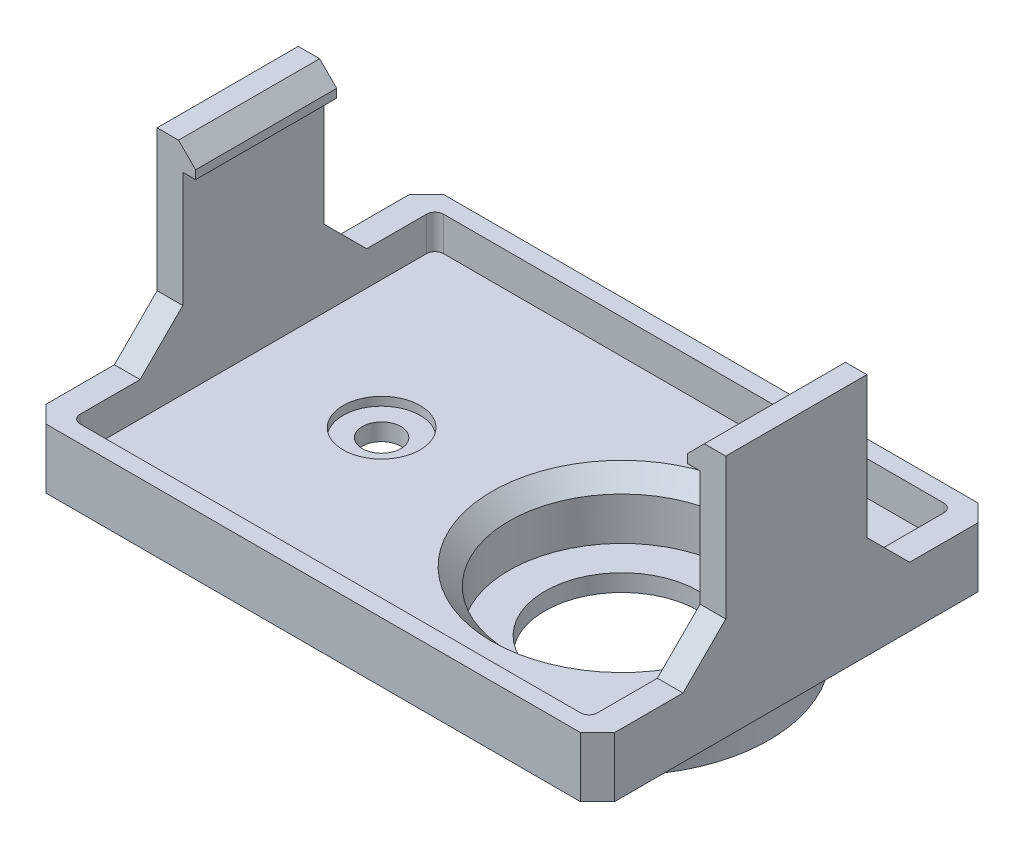
from build123d import *

# Parameters (mm, degrees)
SKETCH1_W           = 66.5
SKETCH1_H           = 46.5
BOSS_EXTRUDE1_DEPTH = 3
SKETCH2_W           = 60.5
SKETCH2_H           = 42.5
BOSS_EXTRUDE2_DEPTH = 4
SKETCH3_R           = 13.2
CUT_EXTRUDE1_DEPTH  = 4
SKETCH4_R           = 2.25
CUT_EXTRUDE2_DEPTH  = 4
SKETCH5_R           = 4.5
CUT_EXTRUDE3_DEPTH  = 1
SKETCH6_R           = 17.2
SKETCH6_R_2         = 13.2
BOSS_EXTRUDE3_DEPTH = 6
FILLET1_R           = 1
CHAMFER1_SIZE       = 2
SKETCH7_W           = 3
SKETCH7_H           = 16.5
BOSS_EXTRUDE4_DEPTH = 21.5
SKETCH8_W           = 16.5
SKETCH8_H           = 3
BOSS_EXTRUDE5_DEPTH = 1.5
SKETCH9_W           = 16.5
SKETCH9_H           = 3
BOSS_EXTRUDE6_DEPTH = 1.5
CHAMFER2_SIZE       = 2
CHAMFER3_SIZE       = 2
CHAMFER4_SIZE       = 2
CHAMFER5_SIZE       = 5
CHAMFER6_SIZE       = 5
BOSS_EXTRUDE7_START = -2
SKETCH10_R          = 13.2
SKETCH10_R_2        = 9
BOSS_EXTRUDE7_DEPTH = 2


with BuildPart() as part:
    # Sketch1 → Boss-Extrude1 (new body)
    with BuildSketch(Plane(origin=(0, 0, 0), x_dir=(1, 0, 0), z_dir=(0, 1, 0))):
        with Locations((0.065324165, -4.697937132)):
            Rectangle(SKETCH1_W, SKETCH1_H)
    extrude(amount=BOSS_EXTRUDE1_DEPTH)

    # Sketch2 → Boss-Extrude2 (add)
    with BuildSketch(Plane(origin=(0, 3, 0), x_dir=(1, 0, 0), z_dir=(0, 1, 0))):
        Polygon((-30.184675835, 18.552062868), (-33.184675835, 18.552062868), (-33.184675835, 16.552062868), (-33.184675835, -25.947937132), (-33.184675835, -27.947937132), (-30.184675835, -27.947937132), (30.315324165, -27.947937132), (33.315324165, -27.947937132), (33.315324165, -25.947937132), (33.315324165, 16.552062868), (33.315324165, 18.552062868), (30.315324165, 18.552062868), align=None)
        with Locations((0.065324165, -4.697937132)):
            Rectangle(SKETCH2_W, SKETCH2_H, mode=Mode.SUBTRACT)
    extrude(amount=BOSS_EXTRUDE2_DEPTH)

    # Sketch3 → Cut-Extrude1 (cut)
    with BuildSketch(Plane(origin=(0, 3, 0), x_dir=(1, 0, 0), z_dir=(0, 1, 0))):
        with Locations(Location((12.915324165, -4.697937132, 0), (0, 0, 270))):
            Circle(SKETCH3_R)
    extrude(amount=-CUT_EXTRUDE1_DEPTH, mode=Mode.SUBTRACT)

    # Sketch4 → Cut-Extrude2 (cut)
    with BuildSketch(Plane(origin=(0, 3, 0), x_dir=(1, 0, 0), z_dir=(0, 1, 0))):
        with Locations(Location((-15.184675835, -4.697937132, 0), (0, 0, 270))):
            Circle(SKETCH4_R)
    extrude(amount=-CUT_EXTRUDE2_DEPTH, mode=Mode.SUBTRACT)

    # Sketch5 → Cut-Extrude3 (cut)
    with BuildSketch(Plane(origin=(0, 3, 0), x_dir=(1, 0, 0), z_dir=(0, 1, 0))):
        with Locations(Location((-15.184675835, -4.697937132, 0), (0, 0, 270))):
            Circle(SKETCH5_R)
    extrude(amount=-CUT_EXTRUDE3_DEPTH, mode=Mode.SUBTRACT)

    # Sketch6 → Boss-Extrude3 (add)
    with BuildSketch(Plane.XZ):
        with Locations(Location((12.915324165, 4.697937132, 0), (0, 0, 90))):
            Circle(SKETCH6_R)
        with Locations(Location((12.915324165, 4.697937132, 0), (0, 0, 90))):
            Circle(SKETCH6_R_2, mode=Mode.SUBTRACT)
    extrude(amount=BOSS_EXTRUDE3_DEPTH)

    # Fillet1
    fillet1_edges = [part.edges().sort_by_distance(p)[0] for p in [
        (-30.184675835, 5, -16.552062868),
        (30.315324165, 5, -16.552062868),
        (30.315324165, 5, 25.947937132),
        (-30.184675835, 5, 25.947937132),
    ]]
    fillet(fillet1_edges, radius=FILLET1_R)

    # Chamfer1
    chamfer1_edges = [part.edges().sort_by_distance(p)[0] for p in [
        (-33.184675835, 3.5, -18.552062868),
        (33.315324165, 3.5, -18.552062868),
        (33.315324165, 3.5, 27.947937132),
        (-33.184675835, 3.5, 27.947937132),
    ]]
    chamfer(chamfer1_edges, length=CHAMFER1_SIZE)

    # Sketch7 → Boss-Extrude4 (add)
    with BuildSketch(Plane(origin=(0, 7, 0), x_dir=(1, 0, 0), z_dir=(0, 1, 0))):
        with Locations((31.815324165, -4.697937132)):
            Rectangle(SKETCH7_W, SKETCH7_H)
        with Locations((-31.684675835, -4.697937132)):
            Rectangle(SKETCH7_W, SKETCH7_H)
    extrude(amount=BOSS_EXTRUDE4_DEPTH)

    # Sketch8 → Boss-Extrude5 (add)
    with BuildSketch(Plane.ZY.offset(-30.315324165)):
        with Locations((4.697937132, 27)):
            Rectangle(SKETCH8_W, SKETCH8_H)
    extrude(amount=BOSS_EXTRUDE5_DEPTH)

    # Sketch9 → Boss-Extrude6 (add)
    with BuildSketch(Plane(origin=(-30.184675835, 0, 0), x_dir=(0, 0, -1), z_dir=(1, 0, 0))):
        with Locations((-4.697937132, 27)):
            Rectangle(SKETCH9_W, SKETCH9_H)
    extrude(amount=BOSS_EXTRUDE6_DEPTH)

    # Chamfer2
    chamfer2_edges = [part.edges().sort_by_distance(p)[0] for p in [
        (28.815324165, 28.5, 4.697937132),
        (-28.684675835, 28.5, 4.697937132),
    ]]
    chamfer(chamfer2_edges, length=CHAMFER2_SIZE)

    # Chamfer3
    chamfer3_edges = [part.edges().sort_by_distance(p)[0] for p in [
        (12.915324165, 3, -8.502062868),
    ]]
    chamfer(chamfer3_edges, length=CHAMFER3_SIZE)

    # Chamfer4
    chamfer4_edges = [part.edges().sort_by_distance(p)[0] for p in [
        (12.915324165, 0, -12.502062868),
    ]]
    chamfer(chamfer4_edges, length=CHAMFER4_SIZE)

    # Chamfer5
    chamfer5_edges = [part.edges().sort_by_distance(p)[0] for p in [
        (31.815324165, 7, -3.552062868),
        (31.815324165, 7, 12.947937132),
    ]]
    chamfer(chamfer5_edges, length=CHAMFER5_SIZE)

    # Chamfer6
    chamfer6_edges = [part.edges().sort_by_distance(p)[0] for p in [
        (-31.684675835, 7, -3.552062868),
        (-31.684675835, 7, 12.947937132),
    ]]
    chamfer(chamfer6_edges, length=CHAMFER6_SIZE)

    # Sketch10 → Boss-Extrude7 (add)
    with BuildSketch(Plane.XZ.offset(6).offset(BOSS_EXTRUDE7_START)):
        with Locations(Location((12.915324165, 4.697937132, 0), (0, 0, 90))):
            Circle(SKETCH10_R)
        with Locations(Location((12.915324165, 4.697937132, 0), (0, 0, 270))):
            Circle(SKETCH10_R_2, mode=Mode.SUBTRACT)
    extrude(amount=BOSS_EXTRUDE7_DEPTH)


solid = part.part
